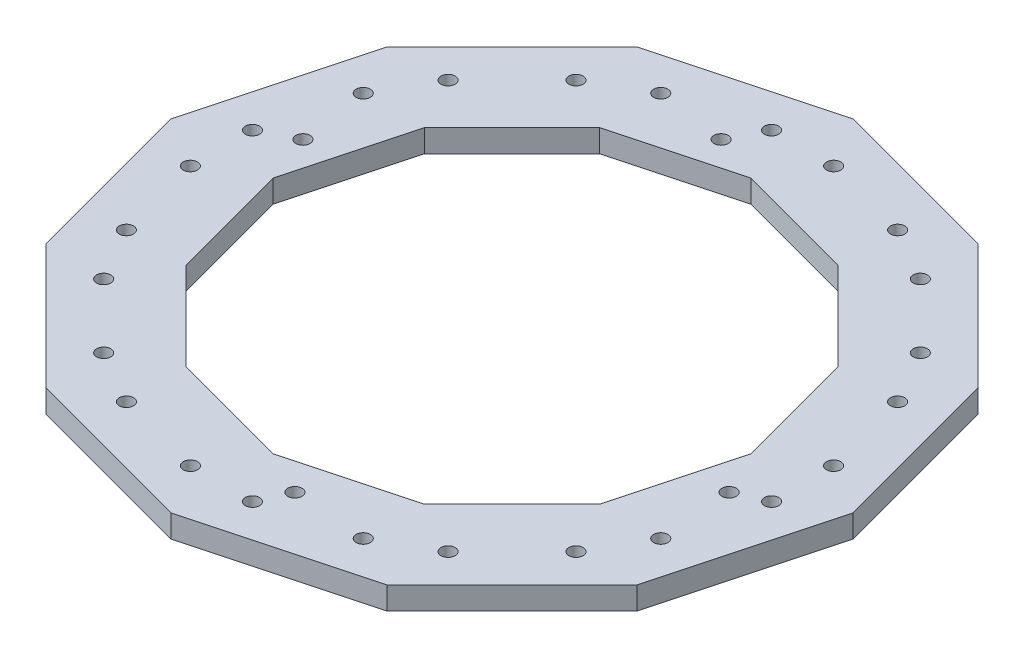
from build123d import *

# Parameters (mm, degrees)
BOSS_EXTRUDE1_DEPTH   = 4
F_2_5MM_DOWEL_HOLE1_D = 2.5
CIRPATTERN2_COUNT     = 12
F_2_5MM_DOWEL_HOLE2_D = 2.5
CUT_EXTRUDE1_DEPTH    = 85.947042326


with BuildPart() as part:
    # Sketch1 → Boss-Extrude1 (new body)
    with BuildSketch(Plane(origin=(0, 0, 0), x_dir=(1, 0, 0), z_dir=(0, 1, 0))):
        Polygon((0, 60), (-30, 51.961524227), (-51.961524227, 30), (-60, 0), (-51.961524227, -30), (-30, -51.961524227), (0, -60), (30, -51.961524227), (51.961524227, -30), (60, 0), (51.961524227, 30), (30, 51.961524227), align=None)
    extrude(amount=BOSS_EXTRUDE1_DEPTH)

    # Ø2.5mm Dowel Hole1 (through all)
    with Locations(Plane(origin=(0, 4, 0), x_dir=(1, 0, 0), z_dir=(0, 1, 0))):
        with Locations((-46.991169754, 20.82821885), (-20.82821885, 46.991169754)):
            f_2_5mm_dowel_hole1 = Hole(F_2_5MM_DOWEL_HOLE1_D / 2)

    # CirPattern2: Ø2.5mm Dowel Hole1 ×12 about axis
    cirpattern2_axis = Axis((0, 4, 0), (0, 1, 0))
    for i in range(1, CIRPATTERN2_COUNT):
        add(f_2_5mm_dowel_hole1.rotate(cirpattern2_axis, i * 360 / CIRPATTERN2_COUNT), mode=Mode.SUBTRACT)

    # Ø2.5mm Dowel Hole2 (through all)
    with Locations(Plane(origin=(0, 4, 0), x_dir=(1, 0, 0), z_dir=(0, 1, 0))):
        with Locations((-45.254833996, 8.485281374), (-8.485281374, 45.254833996), (45.961940777, -7.778174593), (7.778174593, -45.961940777)):
            Hole(F_2_5MM_DOWEL_HOLE2_D / 2)

    # Sketch10 → Cut-Extrude1 (cut, through all)
    with BuildSketch(Plane(origin=(0, 4, 0), x_dir=(1, 0, 0), z_dir=(0, 1, 0))):
        Polygon((0, 42), (-21, 36.373066959), (-36.373066959, 21), (-42, 0), (-36.373066959, -21), (-21, -36.373066959), (0, -42), (21, -36.373066959), (36.373066959, -21), (42, 0), (36.373066959, 21), (21, 36.373066959), align=None)
    extrude(amount=-CUT_EXTRUDE1_DEPTH, mode=Mode.SUBTRACT)


solid = part.part
